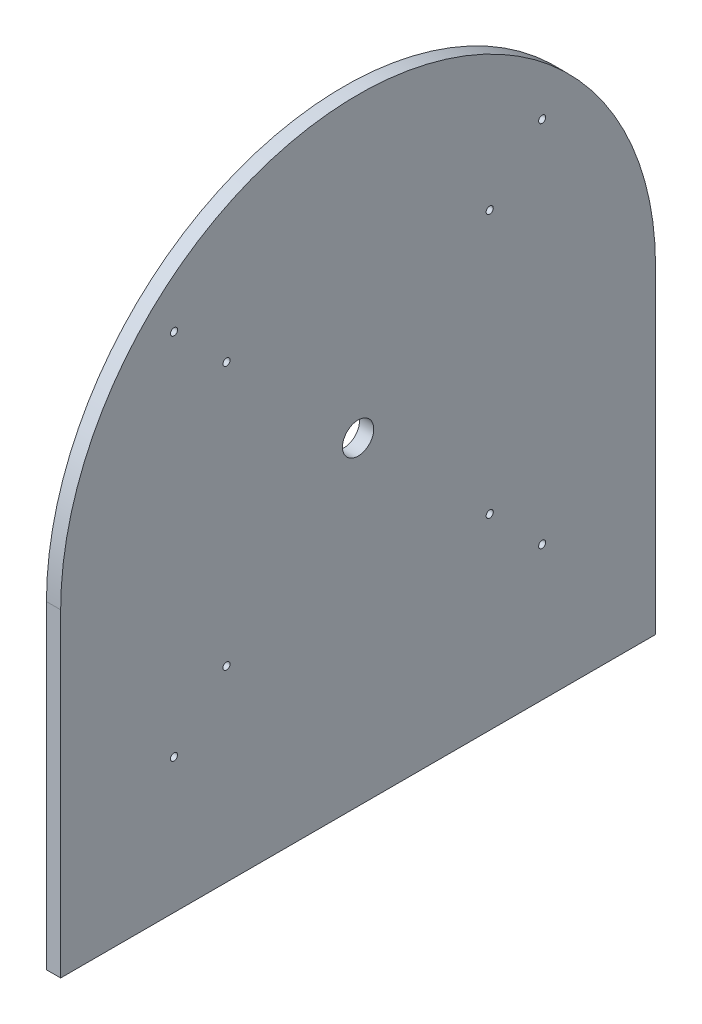
from build123d import *

# Parameters (mm, degrees)
BOSS_EXTRUDE1_DEPTH = 10
SKETCH2_R           = 2.5
CUT_EXTRUDE1_DEPTH  = 10
SKETCH3_R           = 11
CUT_EXTRUDE2_DEPTH  = 10


with BuildPart() as part:
    # Sketch1 → Boss-Extrude1 (new body)
    with BuildSketch(Plane(origin=(0, 0, 0), x_dir=(0, 0, -1), z_dir=(1, 0, 0))):
        with BuildLine():
            ThreePointArc((-209.31, 0), (0, -209.31), (209.31, 0))
            Line((209.31, 0), (-209.31, 0))
        make_face()
        with BuildLine():
            Line((-209.31, 0), (209.31, 0))
            ThreePointArc((209.31, 0), (0, 209.31), (-209.31, 0))
        make_face()
        with BuildLine():
            Line((-209.31, -224.4), (209.31, -224.4))
            Line((209.31, -224.4), (209.31, 0))
            ThreePointArc((209.31, 0), (0, -209.31), (-209.31, 0))
            Line((-209.31, 0), (-209.31, -224.4))
        make_face()
    extrude(amount=BOSS_EXTRUDE1_DEPTH)

    # Sketch2 → Cut-Extrude1 (cut)
    with BuildSketch(Plane(origin=(10, 0, 0), x_dir=(0, 0, -1), z_dir=(1, 0, 0))):
        with Locations((129.534891246, 129.534891246)):
            Circle(SKETCH2_R)
        with Locations((92.609775132, 92.609775132)):
            Circle(SKETCH2_R)
        with Locations((92.609775132, -92.609775132)):
            Circle(SKETCH2_R)
        with Locations((129.534891246, -129.534891246)):
            Circle(SKETCH2_R)
        with Locations((-92.609775132, -92.609775132)):
            Circle(SKETCH2_R)
        with Locations((-129.534891246, -129.534891246)):
            Circle(SKETCH2_R)
        with Locations((-92.609775132, 92.609775132)):
            Circle(SKETCH2_R)
        with Locations((-129.534891246, 129.534891246)):
            Circle(SKETCH2_R)
    extrude(amount=-CUT_EXTRUDE1_DEPTH, mode=Mode.SUBTRACT)

    # Sketch3 → Cut-Extrude2 (cut)
    with BuildSketch(Plane(origin=(10, 0, 0), x_dir=(0, 0, -1), z_dir=(1, 0, 0))):
        Circle(SKETCH3_R)
    extrude(amount=-CUT_EXTRUDE2_DEPTH, mode=Mode.SUBTRACT)


solid = part.part
